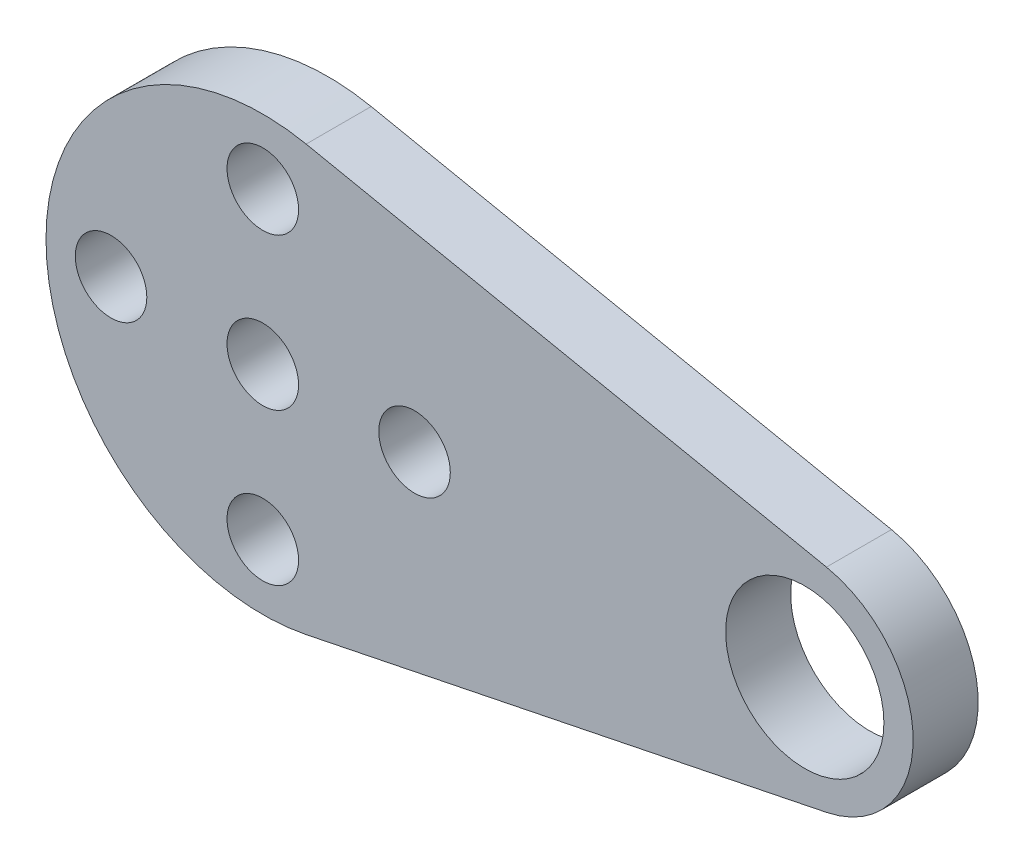
from build123d import *

# Parameters (mm, degrees)
SKETCH_1_R      = 1.65
SKETCH_1_R_2    = 3.65
EXTRUDE_1_DEPTH = 3


with BuildPart() as part:
    # 草图1 → 凸台-拉伸1 (new body)
    with BuildSketch(Plane.XY):
        with BuildLine():
            Line((35.999999862, 9.898979514), (11.999999983, 14.797958975))
            ThreePointArc((11.999999983, 14.797958975), (0, 5.00000007), (11.999999846, -4.797959003))
            Line((11.999999846, -4.797959003), (35.999999968, 0.101020508))
            ThreePointArc((35.999999968, 0.101020508), (40, 5.000000054), (35.999999862, 9.898979514))
        make_face()
        with Locations((10, -2)):
            Circle(SKETCH_1_R, mode=Mode.SUBTRACT)
        with Locations((3, 5)):
            Circle(SKETCH_1_R, mode=Mode.SUBTRACT)
        with Locations((10, 5)):
            Circle(SKETCH_1_R, mode=Mode.SUBTRACT)
        with Locations((17, 5)):
            Circle(SKETCH_1_R, mode=Mode.SUBTRACT)
        with Locations((10, 12)):
            Circle(SKETCH_1_R, mode=Mode.SUBTRACT)
        with Locations((35, 5)):
            Circle(SKETCH_1_R_2, mode=Mode.SUBTRACT)
    extrude(amount=EXTRUDE_1_DEPTH)


solid = part.part
